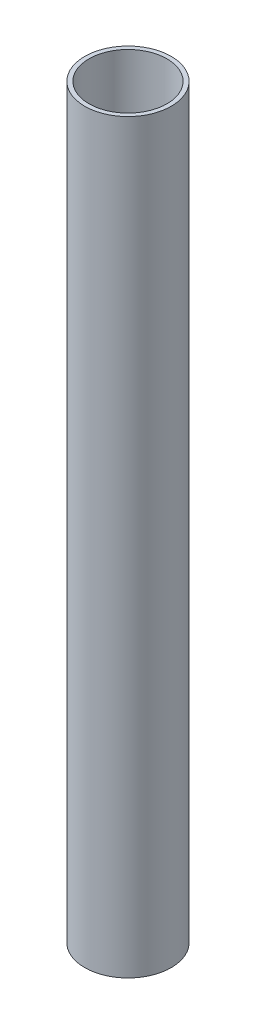
from build123d import *

# Parameters (mm, degrees)
SKETCH1_R           = 12.75
SKETCH1_R_2         = 11.5
BOSS_EXTRUDE1_DEPTH = 110


with BuildPart() as part:
    # Sketch1 → Boss-Extrude1 (new, symmetric)
    with BuildSketch(Plane(origin=(0, 0, 0), x_dir=(1, 0, 0), z_dir=(0, 1, 0))):
        with Locations(Location((0, 0, 0), (0, 0, 270))):
            Circle(SKETCH1_R)
        with Locations(Location((0, 0, 0), (0, 0, 270))):
            Circle(SKETCH1_R_2, mode=Mode.SUBTRACT)
    extrude(amount=BOSS_EXTRUDE1_DEPTH, both=True)


solid = part.part
